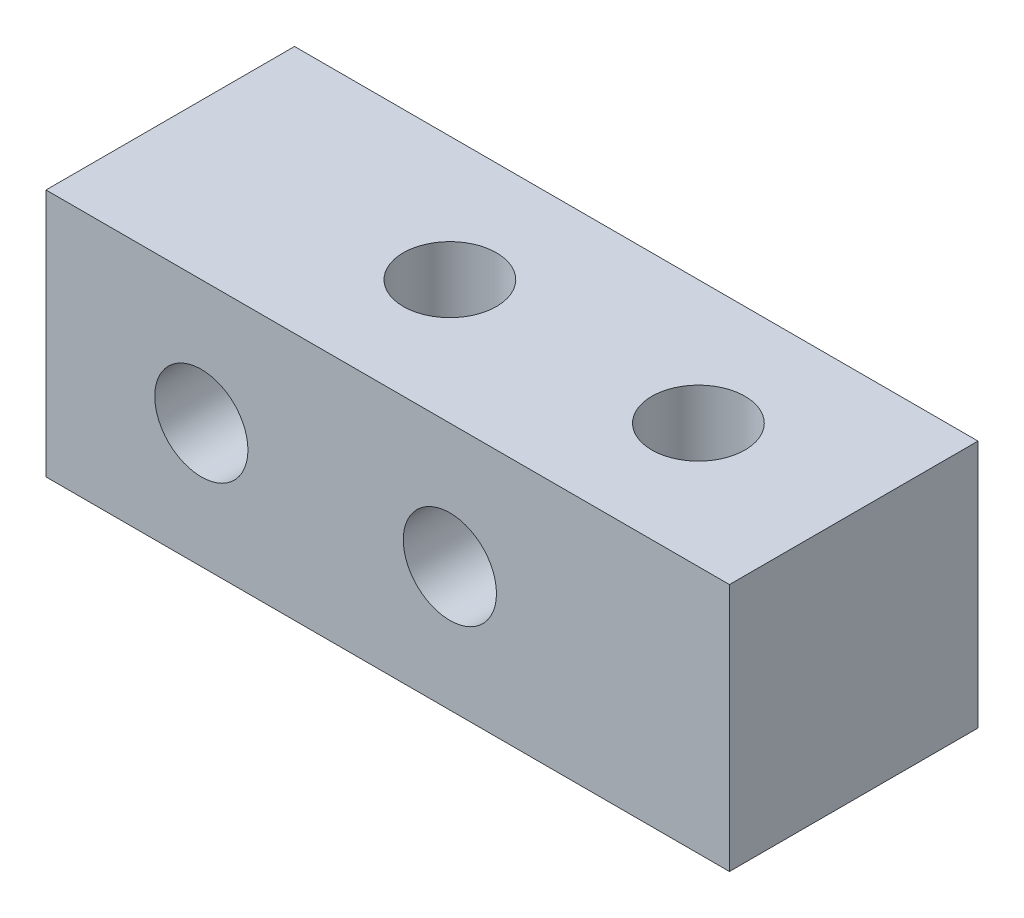
from build123d import *

# Parameters (mm, degrees)
SKETCH_1_W          = 22
SKETCH_1_H          = 8
SKETCH_1_R          = 1.5
EXTRUDE_1_DEPTH     = 8
SKETCH_2_R          = 1.5
CUT_EXTRUDE_1_DEPTH = 8


with BuildPart() as part:
    # 草图1 → 凸台-拉伸1 (new body)
    with BuildSketch(Plane(origin=(0, 0, 0), x_dir=(1, 0, 0), z_dir=(0, 1, 0))):
        Rectangle(SKETCH_1_W, SKETCH_1_H)
        with Locations(Location((6, 0, 0), (0, 0, 270))):
            Circle(SKETCH_1_R, mode=Mode.SUBTRACT)
        with Locations(Location((-2, 0, 0), (0, 0, 270))):
            Circle(SKETCH_1_R, mode=Mode.SUBTRACT)
    extrude(amount=EXTRUDE_1_DEPTH)

    # 草图2 → 切除-拉伸1 (cut)
    with BuildSketch(Plane.XY.offset(4)):
        with Locations((-6, 4)):
            Circle(SKETCH_2_R)
        with Locations((2, 4)):
            Circle(SKETCH_2_R)
    extrude(amount=-CUT_EXTRUDE_1_DEPTH, mode=Mode.SUBTRACT)


solid = part.part
